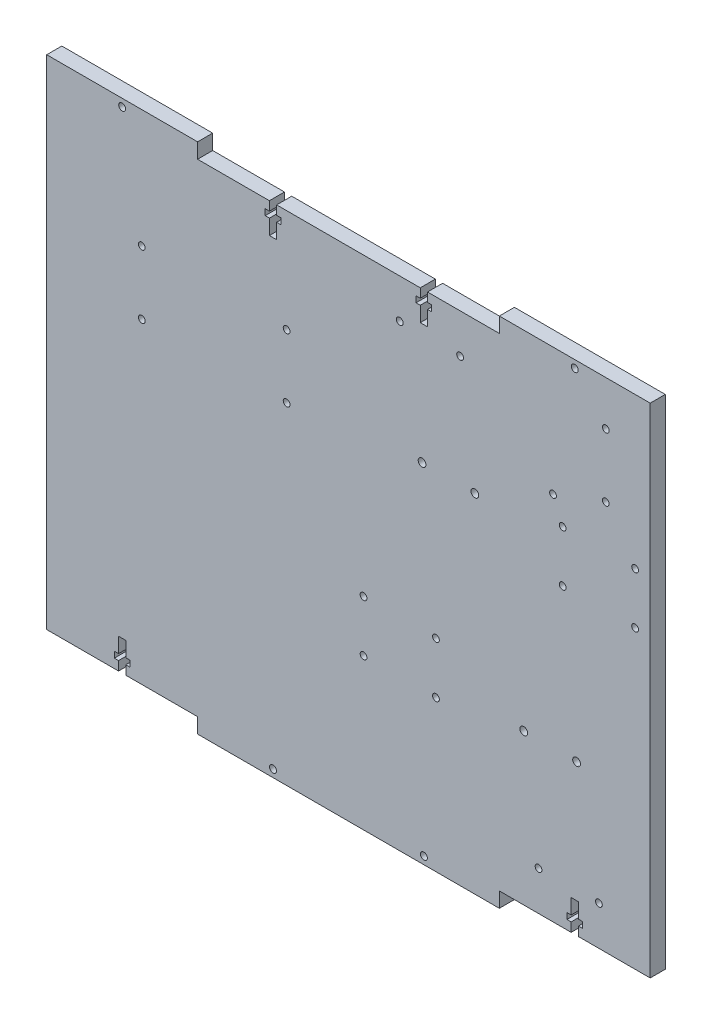
from build123d import *

# Parameters (mm, degrees)
SKETCH1_W           = 63.5
SKETCH1_H           = 6.35
BOSS_EXTRUDE1_DEPTH = 6.35
SKETCH7_R           = 1.4224
SKETCH7_R_2         = 1.63195
CUT_EXTRUDE4_DEPTH  = 257.697479146
SKETCH3_R           = 1.4605
CUT_EXTRUDE5_DEPTH  = 257.697479146
CUT_EXTRUDE6_DEPTH  = 257.697479146
SKETCH10_R          = 1.4224
CUT_EXTRUDE7_DEPTH  = 257.697479146
SKETCH11_R          = 1.4224
CUT_EXTRUDE8_DEPTH  = 257.697479146


with BuildPart() as part:
    # Sketch1 → Boss-Extrude1 (new body)
    with BuildSketch(Plane.XY):
        Polygon((-1.941106456, 35.484446355), (-65.441106456, 35.484446355), (-65.441106456, -167.715553645), (-1.941106456, -167.715553645), (61.558893544, -167.715553645), (61.558893544, -174.065553645), (125.058893544, -174.065553645), (125.058893544, -167.715553645), (188.558893544, -167.715553645), (188.558893544, 41.834446355), (125.058893544, 41.834446355), (125.058893544, 35.484446355), align=None)
        with Locations((-33.691106456, 38.659446355)):
            Rectangle(SKETCH1_W, SKETCH1_H)
        with Locations((29.808893544, -170.890553645)):
            Rectangle(SKETCH1_W, SKETCH1_H)
    extrude(amount=BOSS_EXTRUDE1_DEPTH)

    # Sketch7 → Cut-Extrude4 (cut, through all)
    with BuildSketch(Plane.XY.offset(6.35)):
        with Locations((108.548893544, 18.974446355)):
            Circle(SKETCH7_R)
        with Locations((83.148893544, 18.974446355)):
            Circle(SKETCH7_R)
        with Locations((92.546893544, -27.837753645)):
            Circle(SKETCH7_R_2)
        with Locations((114.771644595, -27.942947347)):
            Circle(SKETCH7_R_2)
        with Locations((67.908893544, -88.975553645)):
            Circle(SKETCH7_R)
        with Locations((98.388893544, -88.975553645)):
            Circle(SKETCH7_R)
        with Locations((98.388893544, -110.565553645)):
            Circle(SKETCH7_R)
        with Locations((67.908893544, -110.565553645)):
            Circle(SKETCH7_R)
        with Locations((141.568893544, -151.205553645)):
            Circle(SKETCH7_R)
        with Locations((166.968893544, -151.205553645)):
            Circle(SKETCH7_R)
        with Locations((135.346142493, -104.288159943)):
            Circle(SKETCH7_R_2)
        with Locations((157.570893544, -104.393353645)):
            Circle(SKETCH7_R_2)
        with Locations((151.728893544, -43.255553645)):
            Circle(SKETCH7_R)
        with Locations((151.728893544, -21.665553645)):
            Circle(SKETCH7_R)
        with Locations((182.208893544, -43.255553645)):
            Circle(SKETCH7_R)
        with Locations((182.208893544, -21.665553645)):
            Circle(SKETCH7_R)
    extrude(amount=-CUT_EXTRUDE4_DEPTH, mode=Mode.SUBTRACT)

    # Sketch3 → Cut-Extrude5 (cut, through all)
    with BuildSketch(Plane.XY.offset(6.35)):
        with Locations((156.808893544, 38.659446355)):
            Circle(SKETCH3_R)
        with Locations((29.808893544, -170.890553645)):
            Circle(SKETCH3_R)
        with Locations(Location((93.308893544, -170.890553645, 0), (0, 0, 180))):
            Circle(SKETCH3_R)
        with Locations(Location((-33.691106456, 38.659446355, 0), (0, 0, 180))):
            Circle(SKETCH3_R)
    extrude(amount=-CUT_EXTRUDE5_DEPTH, mode=Mode.SUBTRACT)

    # Sketch8 → Cut-Extrude6 (cut, through all)
    with BuildSketch(Plane(origin=(0, 0, 0), x_dir=(-1, 0, 0), z_dir=(0, 0, -1))):
        Polygon((-91.784893544, 35.484446355), (-94.832893544, 35.484446355), (-94.832893544, 31.674446355), (-96.610893544, 31.674446355), (-96.610893544, 29.134446355), (-94.832893544, 29.134446355), (-94.832893544, 22.784446355), (-91.784893544, 22.784446355), (-91.784893544, 29.134446355), (-90.006893544, 29.134446355), (-90.006893544, 31.674446355), (-91.784893544, 31.674446355), align=None)
        Polygon((-155.284893544, -167.715553645), (-158.332893544, -167.715553645), (-158.332893544, -163.905553645), (-160.110893544, -163.905553645), (-160.110893544, -161.365553645), (-158.332893544, -161.365553645), (-158.332893544, -155.015553645), (-155.284893544, -155.015553645), (-155.284893544, -161.365553645), (-153.506893544, -161.365553645), (-153.506893544, -163.905553645), (-155.284893544, -163.905553645), align=None)
        Polygon((-31.332893544, 35.484446355), (-28.284893544, 35.484446355), (-28.284893544, 31.674446355), (-26.506893544, 31.674446355), (-26.506893544, 29.134446355), (-28.284893544, 29.134446355), (-28.284893544, 22.784446355), (-31.332893544, 22.784446355), (-31.332893544, 29.134446355), (-33.110893544, 29.134446355), (-33.110893544, 31.674446355), (-31.332893544, 31.674446355), align=None)
        Polygon((32.167106456, -167.715553645), (32.167106456, -163.905553645), (30.389106456, -163.905553645), (30.389106456, -161.365553645), (32.167106456, -161.365553645), (32.167106456, -155.015553645), (35.215106456, -155.015553645), (35.215106456, -161.365553645), (36.993106456, -161.365553645), (36.993106456, -163.905553645), (35.215106456, -163.905553645), (35.215106456, -167.715553645), align=None)
    extrude(amount=-CUT_EXTRUDE6_DEPTH, mode=Mode.SUBTRACT)

    # Sketch10 → Cut-Extrude7 (cut, through all)
    with BuildSketch(Plane.XY.offset(6.35)):
        with Locations((169.889893544, -3.575553701)):
            Circle(SKETCH10_R)
        with Locations((169.889893544, 23.094446299)):
            Circle(SKETCH10_R)
        with Locations((147.664893544, -11.830553701)):
            Circle(SKETCH10_R)
    extrude(amount=-CUT_EXTRUDE7_DEPTH, mode=Mode.SUBTRACT)

    # Sketch11 → Cut-Extrude8 (cut, through all)
    with BuildSketch(Plane.XY.offset(6.35)):
        with Locations((-25.428800612, -7.905553469)):
            Circle(SKETCH11_R)
        with Locations((-25.428800612, -34.575553469)):
            Circle(SKETCH11_R)
        with Locations((35.531199388, -34.575553469)):
            Circle(SKETCH11_R)
        with Locations((35.531199388, -7.905553469)):
            Circle(SKETCH11_R)
    extrude(amount=-CUT_EXTRUDE8_DEPTH, mode=Mode.SUBTRACT)


solid = part.part
